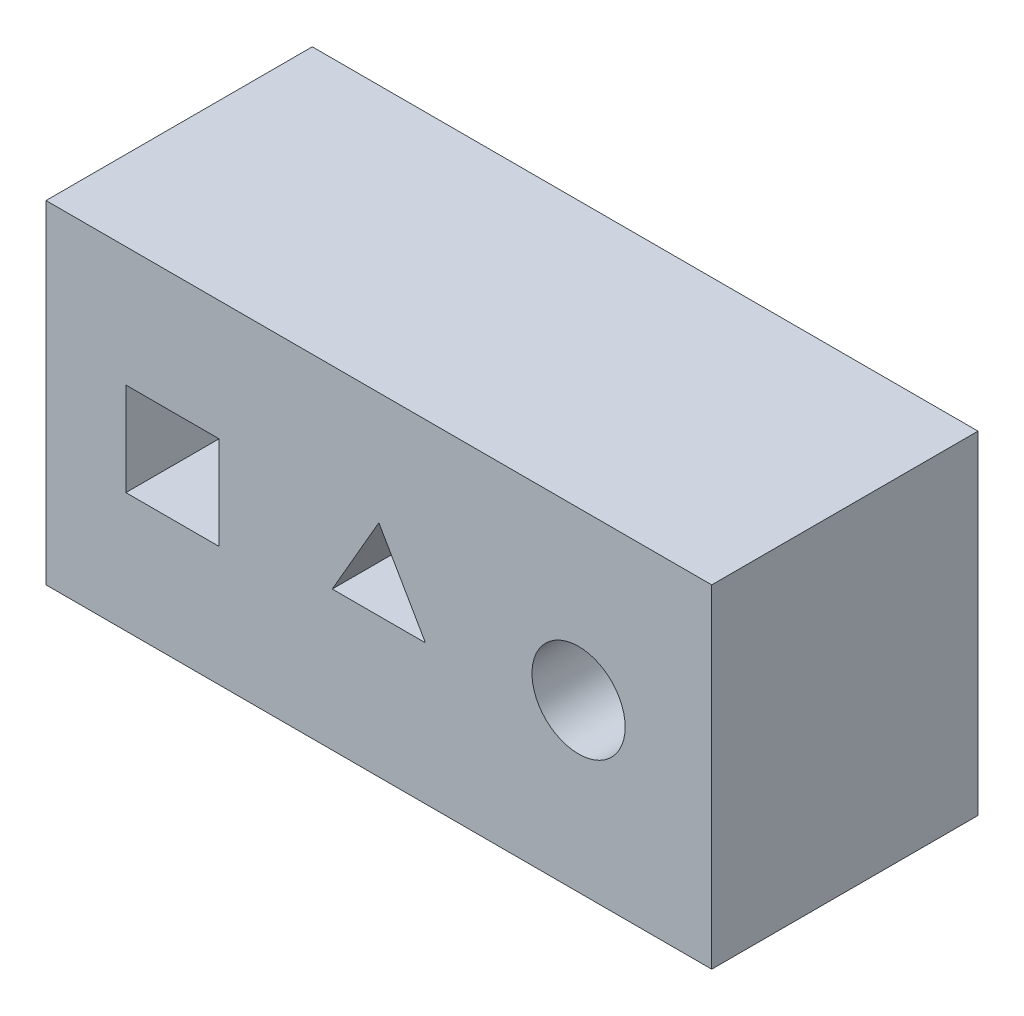
from build123d import *

# Parameters (mm, degrees)
SKETCH1_W           = 250
SKETCH1_H           = 125
SKETCH1_W_2         = 230
SKETCH1_H_2         = 115
BOSS_EXTRUDE1_DEPTH = 100
SKETCH3_W           = 250
SKETCH3_H           = 125
SKETCH3_W_2         = 230
SKETCH3_H_2         = 115
SKETCH3_R           = 17.5
SKETCH3_W_3         = 35
SKETCH3_H_3         = 35
BOSS_EXTRUDE4_DEPTH = 100


with BuildPart() as part:
    # Sketch1 → Boss-Extrude1 (new body)
    with BuildSketch(Plane.XY):
        Rectangle(SKETCH1_W, SKETCH1_H)
        Rectangle(SKETCH1_W_2, SKETCH1_H_2, mode=Mode.SUBTRACT)
    extrude(amount=BOSS_EXTRUDE1_DEPTH)

    # Sketch3 → Boss-Extrude4 (add)
    # profile 1 of 2: a face of its own
    with BuildSketch(Plane.XY.offset(100)):
        Rectangle(SKETCH3_W, SKETCH3_H)
        Rectangle(SKETCH3_W_2, SKETCH3_H_2, mode=Mode.SUBTRACT)
    # profile 2 of 2: a face of its own
    with BuildSketch(Plane.XY.offset(100)):
        Rectangle(SKETCH3_W_2, SKETCH3_H_2)
        with Locations((75, 0)):
            Circle(SKETCH3_R, mode=Mode.SUBTRACT)
        with Locations((-77.5, 0)):
            Rectangle(SKETCH3_W_3, SKETCH3_H_3, mode=Mode.SUBTRACT)
        Polygon((0, 20.207259422), (17.5, -10.103629711), (-17.5, -10.103629711), align=None, mode=Mode.SUBTRACT)
    extrude(amount=-BOSS_EXTRUDE4_DEPTH)


solid = part.part
